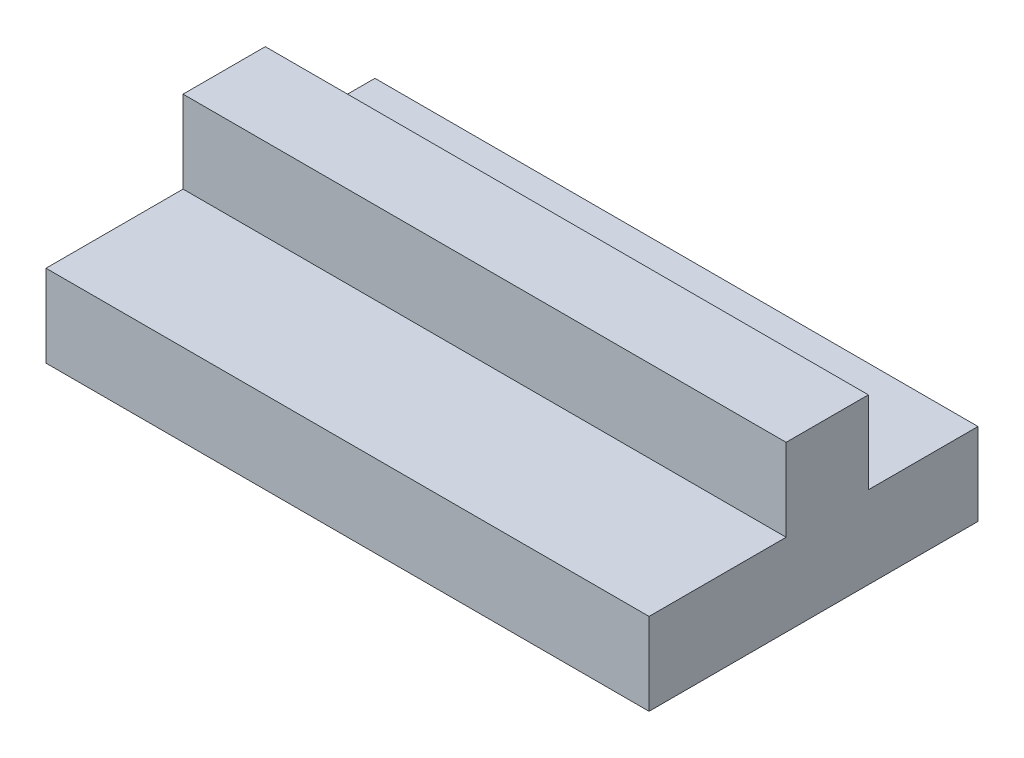
from build123d import *

# Parameters (mm, degrees)
SKETCH_232_W          = 210
SKETCH_232_H          = 53
EXTRUDE_1_DEPTH       = 50
SKETCH_3_W            = 200
SKETCH_3_H            = 43
CUT_EXTRUDE_1_DEPTH   = 45
SKETCH_4_R            = 3.5
EXTRUDE_2_DEPTH       = 2
EXTRUDE_2_TAPER       = 1
FILLET_2_R            = 0.5
SKETCH_4_5_R          = 3.5
EXTRUDE_3_DEPTH       = 2
SKETCH_4_6_R          = 3.5
EXTRUDE_4_DEPTH       = 2
SKETCH_4_7_R          = 3.5
EXTRUDE_5_DEPTH       = 2
FILLET_3_R            = 0.5
FILLET_4_R            = 0.5
FILLET_5_R            = 0.5
SKETCH_7_R            = 6
CUT_EXTRUDE_2_DEPTH   = 14
CUT_EXTRUDE_2_DRAFT   = -5
FILLET_6_R            = 2
SKETCH_8_R            = 7
EXTRUDE_6_DEPTH       = 7
EXTRUDE_6_TAPER       = 5
SKETCH_9_R            = 5.15
CUT_EXTRUDE_3_DEPTH   = 7
CUT_EXTRUDE_3_DRAFT   = 5
SKETCH_10_W           = 29.4
SKETCH_10_H           = 26.3
CUT_EXTRUDE_4_DEPTH   = 5
SKETCH_13_W           = 39.2
SKETCH_13_H           = 27.5
CUT_EXTRUDE_5_DEPTH   = 2
SKETCH_14_W           = 6
SKETCH_14_H           = 6
CUT_EXTRUDE_6_DEPTH   = 5
FILLET_7_R            = 2
EXTRUDE_8_DEPTH       = 3
SKETCH_18_W           = 200
SKETCH_18_H           = 43
SKETCH_18_W_2         = 194
SKETCH_18_H_2         = 37
EXTRUDE_4672_DEPTH    = 3
SKETCH_21_W           = 4.2
SKETCH_21_H           = 2.2
CUT_EXTRUDE_7_DEPTH   = 3
SKETCH_23_OUTSIDE_W   = 255.334
SKETCH_23_OUTSIDE_H   = 98.334
SKETCH_23_OUTSIDE_W_2 = 22
SKETCH_23_OUTSIDE_H_2 = 12
CUT_EXTRUDE_8_DEPTH   = 6


with BuildPart() as part:
    # Sketch 232 → Бобышка-Вытянуть1 (new body)
    with BuildSketch(Plane(origin=(0, 0, 0), x_dir=(1, 0, 0), z_dir=(0, 1, 0))):
        Rectangle(SKETCH_232_W, SKETCH_232_H)
    extrude(amount=EXTRUDE_1_DEPTH)

    # Эскиз3 → Вырез-Вытянуть1 (cut)
    with BuildSketch(Plane.XZ):
        Rectangle(SKETCH_3_W, SKETCH_3_H)
    extrude(amount=-CUT_EXTRUDE_1_DEPTH, mode=Mode.SUBTRACT)

    # Эскиз4 → Бобышка-Вытянуть2 (add)
    with BuildSketch(Plane(origin=(0, 50, 0), x_dir=(1, 0, 0), z_dir=(0, 1, 0))):
        with Locations((98, 19.5)):
            Circle(SKETCH_4_R)
    extrude(amount=EXTRUDE_2_DEPTH, taper=EXTRUDE_2_TAPER)

    # Скругление2
    fillet_2_edges = [part.edges().sort_by_distance(p)[0] for p in [
        (94.53491013, 52, -19.5),
    ]]
    fillet(fillet_2_edges, radius=FILLET_2_R)

    # Эскиз4<5> → Бобышка-Вытянуть3 (add)
    with BuildSketch(Plane(origin=(0, 50, 0), x_dir=(1, 0, 0), z_dir=(0, 1, 0))):
        with Locations(Location((98, -19.5, 0), (0, 0, 90))):
            Circle(SKETCH_4_5_R)
    extrude(amount=EXTRUDE_3_DEPTH)

    # Эскиз4<6> → Бобышка-Вытянуть4 (add)
    with BuildSketch(Plane(origin=(0, 50, 0), x_dir=(1, 0, 0), z_dir=(0, 1, 0))):
        with Locations(Location((-98, -19.5, 0), (0, 0, 270))):
            Circle(SKETCH_4_6_R)
    extrude(amount=EXTRUDE_4_DEPTH)

    # Эскиз4<7> → Бобышка-Вытянуть5 (add)
    with BuildSketch(Plane(origin=(0, 50, 0), x_dir=(1, 0, 0), z_dir=(0, 1, 0))):
        with Locations(Location((-98, 19.5, 0), (0, 0, 90))):
            Circle(SKETCH_4_7_R)
    extrude(amount=EXTRUDE_5_DEPTH)

    # Скругление3
    fillet_3_edges = [part.edges().sort_by_distance(p)[0] for p in [
        (-98, 52, 16),
    ]]
    fillet(fillet_3_edges, radius=FILLET_3_R)

    # Скругление4
    fillet_4_edges = [part.edges().sort_by_distance(p)[0] for p in [
        (-98, 52, -16),
    ]]
    fillet(fillet_4_edges, radius=FILLET_4_R)

    # Скругление5
    fillet_5_edges = [part.edges().sort_by_distance(p)[0] for p in [
        (98, 52, 23),
    ]]
    fillet(fillet_5_edges, radius=FILLET_5_R)


with BuildPart() as cut_extrude_2_tool:
    # Эскиз7 → Вырез-Вытянуть2 (with draft: the straight prism first)
    with BuildSketch(Plane(origin=(0, 0, -26.5), x_dir=(-1, 0, 0), z_dir=(0, 0, -1))):
        with Locations((0, 35.081888724)):
            Circle(SKETCH_7_R)
    extrude(amount=-CUT_EXTRUDE_2_DEPTH)
    # Вырез-Вытянуть2: the draft: its side faces are tilted about the plane it starts from
    cut_extrude_2_sides = [cut_extrude_2_tool.faces().sort_by_distance(p)[0] for p in [
        (6, 35.081888724, -19.5),
    ]]
    draft(cut_extrude_2_sides, Plane(origin=(0, 0, -26.5), x_dir=(-1, 0, 0), z_dir=(0, 0, -1)), CUT_EXTRUDE_2_DRAFT)


with BuildPart() as part_1:
    add(part.part)

    # Вырез-Вытянуть2: cut by cut_extrude_2_tool
    add(cut_extrude_2_tool.part, mode=Mode.SUBTRACT)

    # Скругление6
    fillet_6_edges = [part_1.edges().sort_by_distance(p)[0] for p in [
        (6, 35.081888724, -26.5),
    ]]
    fillet(fillet_6_edges, radius=FILLET_6_R)

    # Эскиз8 → Бобышка-Вытянуть6 (add)
    with BuildSketch(Plane.XY.offset(-21.5)):
        with Locations((0, 35.081888724)):
            Circle(SKETCH_8_R)
    extrude(amount=EXTRUDE_6_DEPTH, taper=EXTRUDE_6_TAPER)


with BuildPart() as cut_extrude_3_tool:
    # Эскиз9 → Вырез-Вытянуть3 (with draft: the straight prism first)
    with BuildSketch(Plane.XY.offset(-14.5)):
        with Locations((0, 35.081888724)):
            Circle(SKETCH_9_R)
    extrude(amount=-CUT_EXTRUDE_3_DEPTH)
    # Вырез-Вытянуть3: the draft: its side faces are tilted about the plane it starts from
    cut_extrude_3_sides = [cut_extrude_3_tool.faces().sort_by_distance(p)[0] for p in [
        (-5.15, 35.081888724, -18),
    ]]
    draft(cut_extrude_3_sides, Plane.XY.offset(-14.5), CUT_EXTRUDE_3_DRAFT)


with BuildPart() as part_2:
    add(part_1.part)

    # Вырез-Вытянуть3: cut by cut_extrude_3_tool
    add(cut_extrude_3_tool.part, mode=Mode.SUBTRACT)

    # Эскиз10 → Вырез-Вытянуть4 (cut)
    with BuildSketch(Plane.XY.offset(26.5)):
        with Locations((-50, 25)):
            Rectangle(SKETCH_10_W, SKETCH_10_H)
    extrude(amount=-CUT_EXTRUDE_4_DEPTH, mode=Mode.SUBTRACT)

    # Эскиз13 → Вырез-Вытянуть5 (cut)
    with BuildSketch(Plane(origin=(0, 0, 21.5), x_dir=(-1, 0, 0), z_dir=(0, 0, -1))):
        with Locations((50, 25)):
            Rectangle(SKETCH_13_W, SKETCH_13_H)
    extrude(amount=-CUT_EXTRUDE_5_DEPTH, mode=Mode.SUBTRACT)

    # Эскиз14 → Вырез-Вытянуть6 (cut)
    with BuildSketch(Plane.XY.offset(26.5)):
        with Locations((-76.5, 31.8)):
            Rectangle(SKETCH_14_W, SKETCH_14_H)
        with Locations((-76.5, 18.2)):
            Rectangle(SKETCH_14_W, SKETCH_14_H)
    extrude(amount=-CUT_EXTRUDE_6_DEPTH, mode=Mode.SUBTRACT)

    # Скругление7
    fillet_7_edges = [part_2.edges().sort_by_distance(p)[0] for p in [
        (-105, 50, 0),
        (0, 50, 26.5),
        (105, 50, 0),
        (105, 25, 26.5),
        (-105, 25, 26.5),
        (-105, 25, -26.5),
        (105, 25, -26.5),
        (0, 50, -26.5),
    ]]
    fillet(fillet_7_edges, radius=FILLET_7_R)


with BuildPart() as body_2:
    # Эскиз17 → Бобышка-Вытянуть8 (new body)
    with BuildSketch(Plane.XZ):
        with BuildLine():
            Line((-105, 24.5), (-105, -24.5))
            ThreePointArc((-105, -24.5), (-104.414213562, -25.914213562), (-103, -26.5))
            Line((-103, -26.5), (103, -26.5))
            ThreePointArc((103, -26.5), (104.414213562, -25.914213562), (105, -24.5))
            Line((105, -24.5), (105, 24.5))
            ThreePointArc((105, 24.5), (104.414213562, 25.914213562), (103, 26.5))
            Line((103, 26.5), (-103, 26.5))
            ThreePointArc((-103, 26.5), (-104.414213562, 25.914213562), (-105, 24.5))
        make_face()
    extrude(amount=EXTRUDE_8_DEPTH)

    # Эскиз18 → Extrude 4672 (add)
    with BuildSketch(Plane(origin=(0, 0, 0), x_dir=(1, 0, 0), z_dir=(0, 1, 0))):
        Rectangle(SKETCH_18_W, SKETCH_18_H)
        Rectangle(SKETCH_18_W_2, SKETCH_18_H_2, mode=Mode.SUBTRACT)
    extrude(amount=EXTRUDE_4672_DEPTH)

    # Эскиз21 → Вырез-Вытянуть7 (cut)
    with BuildSketch(Plane.XZ.offset(3)):
        with Locations((10.5, 16.9)):
            Rectangle(SKETCH_21_W, SKETCH_21_H)
        with Locations((18.5, 16.9)):
            Rectangle(SKETCH_21_W, SKETCH_21_H)
    extrude(amount=-CUT_EXTRUDE_7_DEPTH, mode=Mode.SUBTRACT)

    # Эскиз23 outside → Вырез-Вытянуть8 (cut)
    with BuildSketch(Plane.XZ.offset(3)):
        Rectangle(SKETCH_23_OUTSIDE_W, SKETCH_23_OUTSIDE_H)
        with Locations((14.6, 20.5)):
            Rectangle(SKETCH_23_OUTSIDE_W_2, SKETCH_23_OUTSIDE_H_2, mode=Mode.SUBTRACT)
    extrude(amount=-CUT_EXTRUDE_8_DEPTH, mode=Mode.SUBTRACT)


solid = body_2.part
